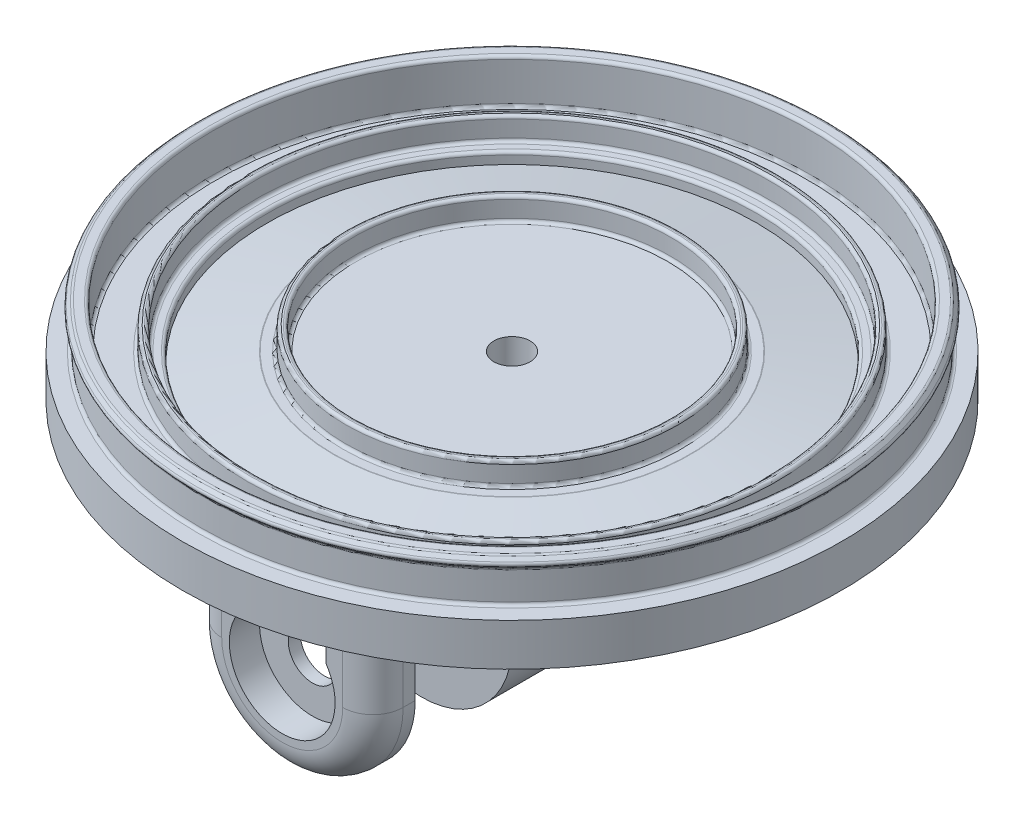
from build123d import *

# Parameters (mm, degrees)
SKETCH2_R                = 54.5
BOSS_EXTRUDE1_DEPTH      = 7
SKETCH4_R                = 43.75
SKETCH4_R_2              = 42.5
SKETCH4_R_3              = 27.5
SKETCH4_R_4              = 26.25
BOSS_EXTRUDE2_DEPTH      = 3.723
FILLET1_R                = 0.5
FILLET2_R                = 0.5
SKETCH6_R                = 3
CUT_EXTRUDE1_DEPTH       = 6
BOSS_EXTRUDE3_DEPTH      = 15
BOSS_EXTRUDE3_DEPTH_BACK = 15
SKETCH7_R                = 4
CUT_EXTRUDE4_DEPTH       = 5
CUT_EXTRUDE4_DEPTH_BACK  = 5
SKETCH10_W               = 38.473117609
SKETCH10_H               = 42.182403499
BOSS_EXTRUDE4_START      = 16
SKETCH11_R               = 4
BOSS_EXTRUDE4_DEPTH      = 2
BOSS_EXTRUDE5_DEPTH      = 5
FILLET3_R                = 5


with BuildPart() as part:
    # Sketch2 → Boss-Extrude1 (new body)
    with BuildSketch(Plane(origin=(0, 0, 0), x_dir=(1, 0, 0), z_dir=(0, 1, 0))):
        with Locations(Location((0, 0, 0), (0, 0, 270))):
            Circle(SKETCH2_R)
    extrude(amount=BOSS_EXTRUDE1_DEPTH)

    # Sketch3 → Cut-Revolve1 (revolve, cut)
    with BuildSketch(Plane.XY, mode=Mode.PRIVATE) as cut_revolve1_sk:
        Polygon((-29.5, 7), (-40.5, 7), (-40.5, 5.127), align=None)
    revolve(cut_revolve1_sk.sketch.rotate(Axis((0, 0, 0), (0, 1, 0)), 270), axis=Axis((0, 0, 0), (0, 1, 0)), mode=Mode.SUBTRACT)

    # Sketch4 → Boss-Extrude2 (add)
    # profile 1 of 2: a face of its own
    with BuildSketch(Plane(origin=(0, 7, 0), x_dir=(1, 0, 0), z_dir=(0, 1, 0))):
        with Locations(Location((0, 0, 0), (0, 0, 270))):
            Circle(SKETCH4_R)
        with Locations(Location((0, 0, 0), (0, 0, 270))):
            Circle(SKETCH4_R_2, mode=Mode.SUBTRACT)
    # profile 2 of 2: a face of its own
    with BuildSketch(Plane(origin=(0, 7, 0), x_dir=(1, 0, 0), z_dir=(0, 1, 0))):
        with Locations(Location((0, 0, 0), (0, 0, 270))):
            Circle(SKETCH4_R_3)
        with Locations(Location((0, 0, 0), (0, 0, 270))):
            Circle(SKETCH4_R_4, mode=Mode.SUBTRACT)
    extrude(amount=BOSS_EXTRUDE2_DEPTH)

    # Fillet1
    fillet1_edges = [part.edges().sort_by_distance(p)[0] for p in [
        (0, 7, -43.75),
        (0, 10.723, -42.5),
        (0, 10.723, -43.75),
        (0, 7, -42.5),
        (0, 7, -27.5),
        (0, 10.723, -26.25),
        (0, 10.723, -27.5),
        (0, 7, -26.25),
        (0, 7, 40.5),
        (0, 7, 29.5),
    ]]
    fillet(fillet1_edges, radius=FILLET1_R)

    # Sketch5 → Revolve1 (revolve)
    with BuildSketch(Plane.XY, mode=Mode.PRIVATE) as revolve1_sk:
        Polygon((-49.5, 7), (-51.5, 7), (-51.5, 12.323), (-52.5, 13.323), (-51.5, 14.323), (-49.5, 14.323), align=None)
    revolve(revolve1_sk.sketch.rotate(Axis((0, 7, 0), (0, 1, 0)), 180), axis=Axis((0, 7, 0), (0, 1, 0)))

    # Fillet2
    fillet2_edges = [part.edges().sort_by_distance(p)[0] for p in [
        (-49.5, 7, 0),
        (-51.5, 7, 0),
        (-51.5, 12.323, 0),
        (-52.5, 13.323, 0),
        (-51.5, 14.323, 0),
        (-49.5, 14.323, 0),
    ]]
    fillet(fillet2_edges, radius=FILLET2_R)

    # Sketch6 → Cut-Extrude1 (cut)
    with BuildSketch(Plane(origin=(0, 7, 0), x_dir=(1, 0, 0), z_dir=(0, 1, 0))):
        with Locations(Location((0, 0, 0), (0, 0, 270))):
            Circle(SKETCH6_R)
    extrude(amount=-CUT_EXTRUDE1_DEPTH, mode=Mode.SUBTRACT)

    # Sketch7 → Boss-Extrude3 (add, two sides: drawn at the far end of the back side and taken through both)
    with BuildSketch(Plane.XY.offset(-BOSS_EXTRUDE3_DEPTH_BACK)):
        with BuildLine():
            Line((15, 0), (-15, 0))
            Line((-15, 0), (-15, -20))
            ThreePointArc((-15, -20), (0, -35), (15, -20))
            Line((15, -20), (15, 0))
        make_face()
        with Locations((0, -20)):
            Circle(SKETCH7_R, mode=Mode.SUBTRACT)
    extrude(amount=BOSS_EXTRUDE3_DEPTH + BOSS_EXTRUDE3_DEPTH_BACK)

    # Sketch10 → Cut-Extrude4 (cut, two sides: drawn at the far end of the back side and taken through both)
    with BuildSketch(Plane.XY.offset(-CUT_EXTRUDE4_DEPTH_BACK)):
        with Locations((1.71649294, -21.09120175)):
            Rectangle(SKETCH10_W, SKETCH10_H)
    extrude(amount=CUT_EXTRUDE4_DEPTH + CUT_EXTRUDE4_DEPTH_BACK, mode=Mode.SUBTRACT)

    # Sketch11 → Boss-Extrude4 (add)
    with BuildSketch(Plane.XY.offset(15).offset(BOSS_EXTRUDE4_START)):
        with BuildLine():
            Line((-15, 0), (-15, -20))
            ThreePointArc((-15, -20), (0, -35), (15, -20))
            Line((15, -20), (15, 0))
            Line((15, 0), (-15, 0))
        make_face()
        with Locations((0, -20)):
            Circle(SKETCH11_R, mode=Mode.SUBTRACT)
    extrude(amount=BOSS_EXTRUDE4_DEPTH)

    # Sketch12 → Boss-Extrude5 (add)
    with BuildSketch(Plane.XY.offset(33)):
        with BuildLine():
            Line((-7.25, -15.101020514), (-7.25, 0))
            Line((-7.25, 0), (-15, 0))
            Line((-15, 0), (-15, -20))
            ThreePointArc((-15, -20), (0, -35), (15, -20))
            Line((15, -20), (15, 0))
            Line((15, 0), (7.25, 0))
            Line((7.25, 0), (7.25, -15.101020514))
            ThreePointArc((7.25, -15.101020514), (8.366600265, -17.438262309), (8.75, -20))
            ThreePointArc((8.75, -20), (-2.561737691, -28.366600265), (-7.25, -15.101020514))
        make_face()
    extrude(amount=BOSS_EXTRUDE5_DEPTH)

    # Fillet3
    fillet3_edges = [part.edges().sort_by_distance(p)[0] for p in [
        (-15, 0, 34.5),
        (15, 0, 34.5),
        (-11.125, 0, 38),
        (-15, -10, 38),
        (0, -35, 38),
        (15, -10, 38),
        (11.125, 0, 38),
    ]]
    fillet(fillet3_edges, radius=FILLET3_R)


solid = part.part
